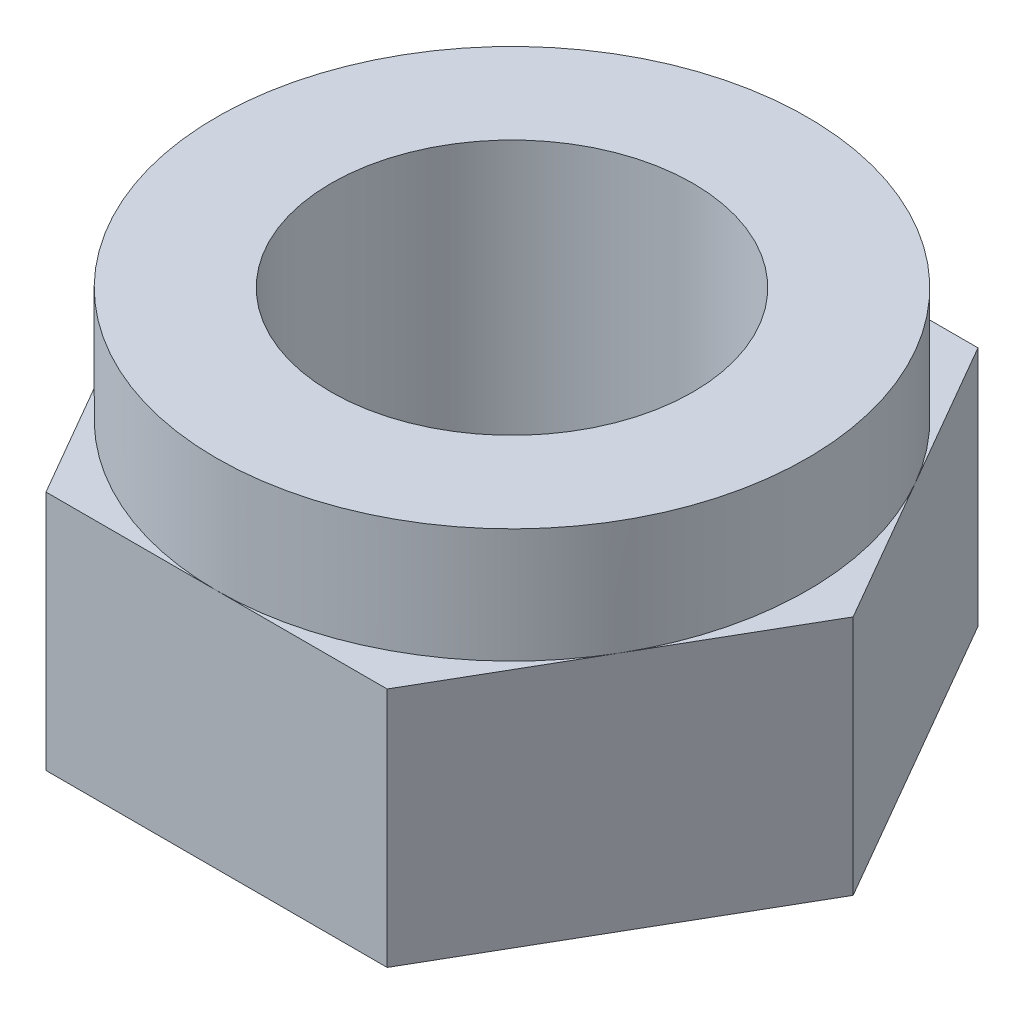
from build123d import *

# Parameters (mm, degrees)
EXTRUDE_1_DEPTH     = 4
EXTRUDE_START       = 4
SKETCH_2_R          = 4.9
EXTRUDE_2_DEPTH     = 1.9
CUT_EXTRUDE_1_REACH = 11.531
SKETCH_3_R          = 3


with BuildPart() as part:
    # 草图1 → 凸台-拉伸1 (new body)
    with BuildSketch(Plane(origin=(0, 0, 0), x_dir=(1, 0, 0), z_dir=(0, 1, 0))):
        Polygon((5.658032638, 0), (2.829016319, 4.9), (-2.829016319, 4.9), (-5.658032638, 0), (-2.829016319, -4.9), (2.829016319, -4.9), align=None)
    extrude(amount=EXTRUDE_1_DEPTH)

    # 草图2 → 凸台-拉伸2 (add)
    with BuildSketch(Plane(origin=(0, 0, 0), x_dir=(1, 0, 0), z_dir=(0, 1, 0)).offset(EXTRUDE_START)):
        with Locations(Location((0, 0, 0), (0, 0, 270))):
            Circle(SKETCH_2_R)
    extrude(amount=EXTRUDE_2_DEPTH)

    # 草图3 → 切除-拉伸1 (cut, up to next)
    with BuildSketch(Plane(origin=(0, 0, 0), x_dir=(1, 0, 0), z_dir=(0, 1, 0)), mode=Mode.PRIVATE) as cut_extrude_1_sk1:
        with Locations(Location((0, 0, 0), (0, 0, 270))):
            Circle(SKETCH_3_R)
    cut_extrude_1_tool1 = extrude(cut_extrude_1_sk1.sketch, amount=CUT_EXTRUDE_1_REACH, mode=Mode.PRIVATE) & part.part
    add(cut_extrude_1_tool1.solids().sort_by_distance((0, 0, 0))[0], mode=Mode.SUBTRACT)


solid = part.part
